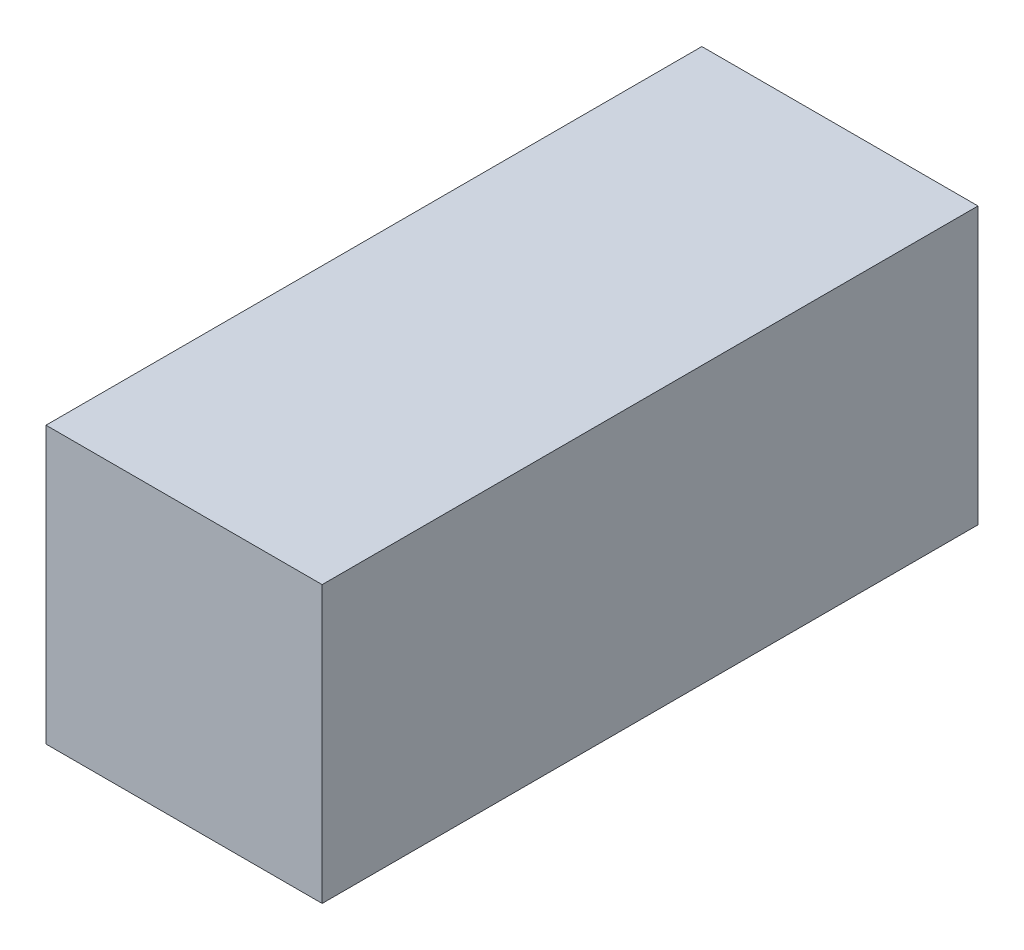
from build123d import *

# Parameters (mm, degrees)
SKETCH1_W           = 4
SKETCH1_H           = 4
BOSS_EXTRUDE1_DEPTH = 9.5


with BuildPart() as part:
    # Sketch1 → Boss-Extrude1 (new body)
    with BuildSketch(Plane.XY):
        Rectangle(SKETCH1_W, SKETCH1_H)
    extrude(amount=BOSS_EXTRUDE1_DEPTH)


solid = part.part
